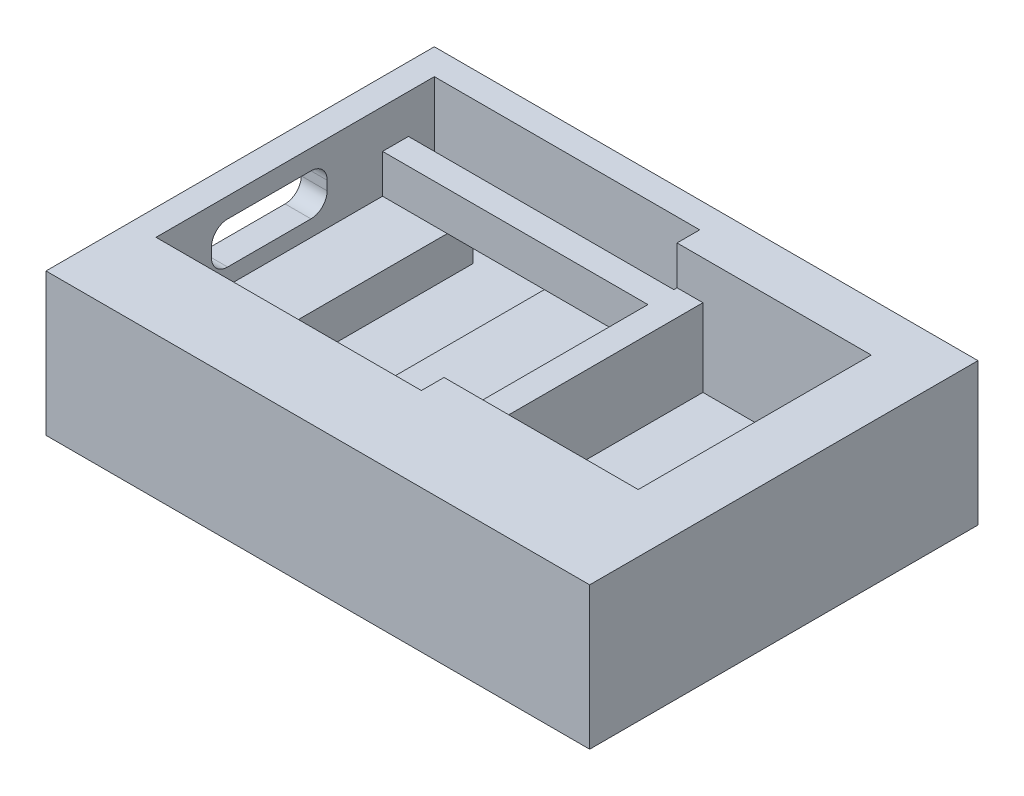
from build123d import *

# Parameters (mm, degrees)
BOSS_EXTRUDE1_DEPTH = 2
SKETCH2_W           = 20.5
SKETCH2_H           = 2
SKETCH2_W_2         = 13
SKETCH2_H_2         = 18
SKETCH2_H_3         = 17.5
BOSS_EXTRUDE2_DEPTH = 9
SKETCH3_W           = 5
SKETCH3_H           = 3
SKETCH3_W_2         = 8
BOSS_EXTRUDE4_DEPTH = 17.5
SKETCH6_W           = 7.5
SKETCH6_H           = 3
CUT_EXTRUDE1_DEPTH  = 2.5
CUT_EXTRUDE3_DEPTH  = 3
SKETCH11_W          = 15
SKETCH11_H          = 11
BOSS_EXTRUDE5_DEPTH = 1.75
SKETCH12_W          = 15
SKETCH12_H          = 11
BOSS_EXTRUDE6_DEPTH = 1.75
CUT_EXTRUDE4_DEPTH  = 2
SKETCH14_W          = 39.5
SKETCH14_H          = 11
BOSS_EXTRUDE7_DEPTH = 4.5
SKETCH16_W          = 30
SKETCH16_H          = 11
BOSS_EXTRUDE8_DEPTH = 2.5


with BuildPart() as part:
    # Sketch1 → Boss-Extrude1 (new body)
    with BuildSketch(Plane(origin=(0, 0, 0), x_dir=(1, 0, 0), z_dir=(0, 1, 0))):
        Polygon((0, 25.5), (24.5, 25.5), (24.5, 23.75), (39.5, 23.75), (39.5, 1.75), (24.5, 1.75), (24.5, 0), (0, 0), align=None)
    extrude(amount=BOSS_EXTRUDE1_DEPTH)

    # Sketch2 → Boss-Extrude2 (add)
    with BuildSketch(Plane(origin=(0, 2, 0), x_dir=(1, 0, 0), z_dir=(0, 1, 0))):
        Polygon((24.5, 23.75), (24.5, 25.5), (0, 25.5), (0, 0), (24.5, 0), (24.5, 1.75), (39.5, 1.75), (39.5, 23.75), align=None)
        with Locations((12.25, 22.5)):
            Rectangle(SKETCH2_W, SKETCH2_H, mode=Mode.SUBTRACT)
        with Locations((31, 12.75)):
            Rectangle(SKETCH2_W_2, SKETCH2_H_2, mode=Mode.SUBTRACT)
        with Locations((12.25, 10.75)):
            Rectangle(SKETCH2_W, SKETCH2_H_3, mode=Mode.SUBTRACT)
    extrude(amount=BOSS_EXTRUDE2_DEPTH)

    # Sketch3 → Boss-Extrude4 (add)
    with BuildSketch(Plane.XY.offset(-19.5)):
        with Locations((4.5, 3.5)):
            Rectangle(SKETCH3_W, SKETCH3_H)
        with Locations((18.5, 3.5)):
            Rectangle(SKETCH3_W_2, SKETCH3_H)
    extrude(amount=BOSS_EXTRUDE4_DEPTH)

    # Sketch6 → Cut-Extrude1 (cut)
    with BuildSketch(Plane.XY.offset(-19.5)):
        with Locations((10.75, 3.5)):
            Rectangle(SKETCH6_W, SKETCH6_H)
    extrude(amount=-CUT_EXTRUDE1_DEPTH, mode=Mode.SUBTRACT)

    # Sketch7 → Cut-Extrude3 (cut)
    with BuildSketch(Plane(origin=(0, 11, 0), x_dir=(1, 0, 0), z_dir=(0, 1, 0))):
        Polygon((24.5, 3.75), (22.5, 3.75), (22.5, 19.5), (2, 19.5), (2, 21.5), (22.5, 21.5), (22.5, 21.75), (24.5, 21.75), (24.5, 21.5), (24.5, 19.5), align=None)
    extrude(amount=-CUT_EXTRUDE3_DEPTH, mode=Mode.SUBTRACT)

    # Sketch11 → Boss-Extrude5 (add)
    with BuildSketch(Plane.XY.offset(-1.75)):
        with Locations((32, 5.5)):
            Rectangle(SKETCH11_W, SKETCH11_H)
    extrude(amount=BOSS_EXTRUDE5_DEPTH)

    # Sketch12 → Boss-Extrude6 (add)
    with BuildSketch(Plane(origin=(0, 0, -23.75), x_dir=(-1, 0, 0), z_dir=(0, 0, -1))):
        with Locations((-32, 5.5)):
            Rectangle(SKETCH12_W, SKETCH12_H)
    extrude(amount=BOSS_EXTRUDE6_DEPTH)

    # Sketch13 → Cut-Extrude4 (cut)
    with BuildSketch(Plane(origin=(2, 0, 0), x_dir=(0, 0, -1), z_dir=(1, 0, 0))):
        with BuildLine():
            Line((6.28, 7.5), (6.28, 8.21))
            ThreePointArc((6.28, 8.21), (6.646116524, 9.093883476), (7.53, 9.46))
            Line((7.53, 9.46), (13.97, 9.46))
            ThreePointArc((13.97, 9.46), (14.853883476, 9.093883476), (15.22, 8.21))
            Line((15.22, 8.21), (15.22, 7.5))
            ThreePointArc((15.22, 7.5), (14.853883476, 6.616116524), (13.97, 6.25))
            Line((13.97, 6.25), (7.53, 6.25))
            ThreePointArc((7.53, 6.25), (6.646116524, 6.616116524), (6.28, 7.5))
        make_face()
    extrude(amount=-CUT_EXTRUDE4_DEPTH, mode=Mode.SUBTRACT)

    # Sketch14 → Boss-Extrude7 (add)
    with BuildSketch(Plane.XY):
        with Locations((19.75, 5.5)):
            Rectangle(SKETCH14_W, SKETCH14_H)
    extrude(amount=BOSS_EXTRUDE7_DEPTH)

    # Sketch16 → Boss-Extrude8 (add)
    with BuildSketch(Plane(origin=(39.5, 0, 0), x_dir=(0, 0, -1), z_dir=(1, 0, 0))):
        with Locations((10.5, 5.5)):
            Rectangle(SKETCH16_W, SKETCH16_H)
    extrude(amount=BOSS_EXTRUDE8_DEPTH)


solid = part.part
